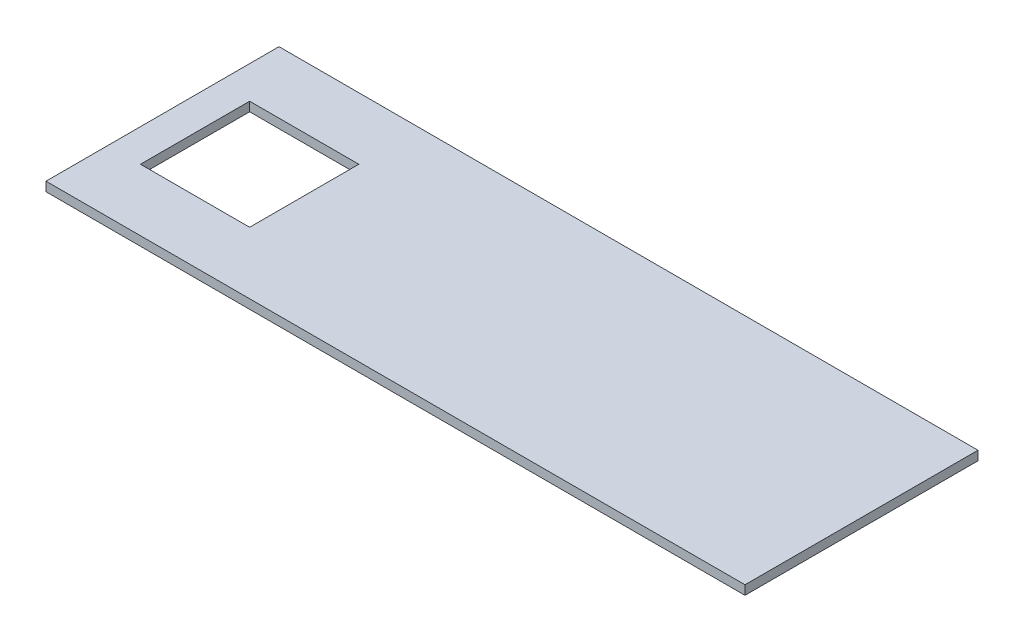
from build123d import *

# Parameters (mm, degrees)
SKETCH_1_W          = 76.2
SKETCH_1_H          = 25.4
EXTRUDE_1_DEPTH     = 1
CUT_EXTRUDE_1_DEPTH = 1


with BuildPart() as part:
    # 草图1 → 凸台-拉伸1 (new body)
    with BuildSketch(Plane(origin=(0, 0, 0), x_dir=(1, 0, 0), z_dir=(0, 1, 0))):
        with Locations((38.1, -12.7)):
            Rectangle(SKETCH_1_W, SKETCH_1_H)
    extrude(amount=EXTRUDE_1_DEPTH)

    # 草图2 → 切除-拉伸1 (cut)
    with BuildSketch(Plane(origin=(0, 1, 0), x_dir=(1, 0, 0), z_dir=(0, 1, 0))):
        Polygon((3.55, -12.7), (3.55, -6.75), (15.45, -6.75), (15.45, -18.65), (3.55, -18.65), align=None)
    extrude(amount=-CUT_EXTRUDE_1_DEPTH, mode=Mode.SUBTRACT)


solid = part.part
